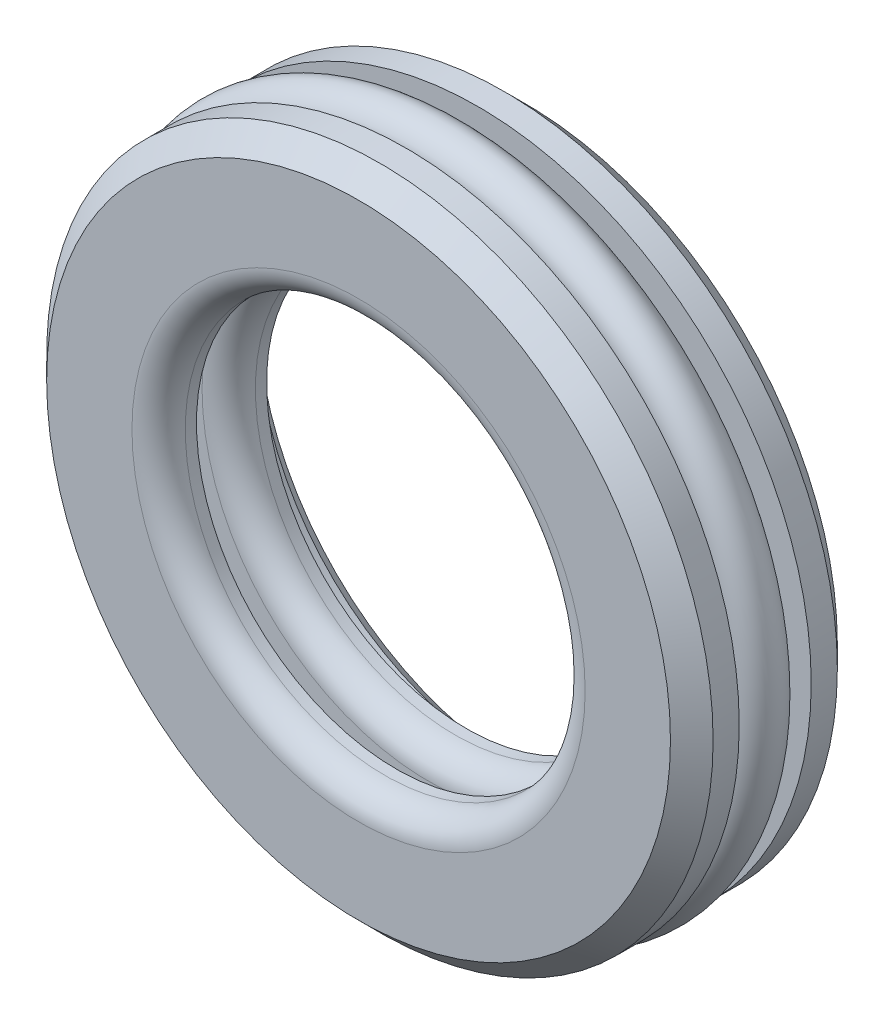
from build123d import *

# Parameters (mm, degrees)
SKETCH2_R = 1.143


with BuildPart() as part:
    # Sketch1 → Revolve1 (revolve)
    with BuildSketch(Plane(origin=(0, 0, 0), x_dir=(0, 0, -1), z_dir=(1, 0, 0)), mode=Mode.PRIVATE) as revolve1_sk:
        with BuildLine():
            Line((-2.9591, 15.875), (-3.9751, 14.859))
            Line((-3.9751, 14.859), (-3.9751, 10.795))
            ThreePointArc((-3.9751, 10.795), (-3.603125612, 9.896974388), (-2.7051, 9.525))
            Line((-2.7051, 9.525), (-2.1717, 9.525))
            Line((-2.1717, 9.525), (-2.1717, 10.16))
            Line((-2.1717, 10.16), (-2.7051, 10.16))
            ThreePointArc((-2.7051, 10.16), (-3.154112806, 10.345987194), (-3.3401, 10.795))
            Line((-3.3401, 10.795), (-3.3401, 11.7475))
            ThreePointArc((-3.3401, 11.7475), (-3.265705122, 11.927105122), (-3.0861, 12.0015))
            Line((-3.0861, 12.0015), (-0.889, 12.0015))
            ThreePointArc((-0.889, 12.0015), (-0.709394878, 11.927105122), (-0.635, 11.7475))
            Line((-0.635, 11.7475), (-0.635, 10.795))
            ThreePointArc((-0.635, 10.795), (-0.263025612, 9.896974388), (0.635, 9.525))
            Line((0.635, 9.525), (1.1684, 9.525))
            Line((1.1684, 9.525), (1.1684, 10.16))
            Line((1.1684, 10.16), (0.635, 10.16))
            ThreePointArc((0.635, 10.16), (0.185987194, 10.345987194), (0, 10.795))
            Line((0, 10.795), (0, 11.7475))
            ThreePointArc((0, 11.7475), (0.074394878, 11.927105122), (0.254, 12.0015))
            Line((0.254, 12.0015), (3.2131, 12.0015))
            Line((3.2131, 12.0015), (3.9751, 12.7635))
            Line((3.9751, 12.7635), (3.9751, 14.859))
            Line((3.9751, 14.859), (2.9591, 15.875))
            Line((2.9591, 15.875), (1.7145, 15.875))
            Line((1.7145, 15.875), (1.7145, 14.4526))
            ThreePointArc((1.7145, 14.4526), (1.528512806, 14.003587194), (1.0795, 13.8176))
            Line((1.0795, 13.8176), (-1.0795, 13.8176))
            ThreePointArc((-1.0795, 13.8176), (-1.528512806, 14.003587194), (-1.7145, 14.4526))
            Line((-1.7145, 14.4526), (-1.7145, 15.875))
            Line((-1.7145, 15.875), (-2.9591, 15.875))
        make_face()
    revolve(revolve1_sk.sketch.rotate(Axis((0, 0, 3.9751), (0, 0, -1)), 90), axis=Axis((0, 0, 3.9751), (0, 0, -1)))


with BuildPart() as body_2:
    # Sketch2 → Revolve2 (revolve)
    with BuildSketch(Plane(origin=(0, 0, 0), x_dir=(0, 0, -1), z_dir=(1, 0, 0)), mode=Mode.PRIVATE) as revolve2_sk:
        with Locations((0, 14.9606)):
            Circle(SKETCH2_R)
    revolve(revolve2_sk.sketch.rotate(Axis((0, 0, 3.9751), (0, 0, -1)), 270), axis=Axis((0, 0, 3.9751), (0, 0, -1)))


solid = Compound([part.part, body_2.part])
